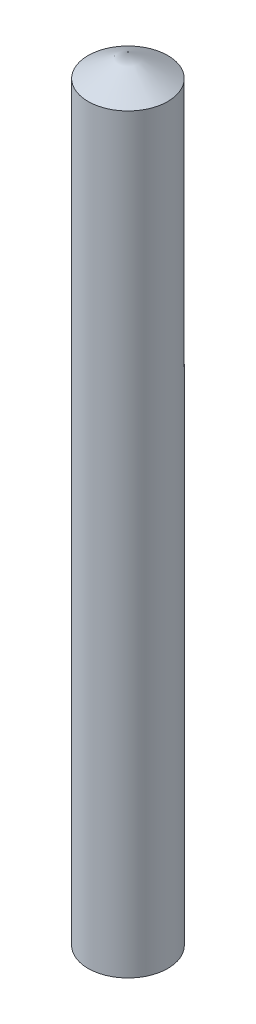
from build123d import *


with BuildPart() as part:
    # Sketch1 → Revolve1 (revolve)
    with BuildSketch(Plane(origin=(0, 0, 0), x_dir=(0, 0, -1), z_dir=(1, 0, 0))):
        Polygon((-30, 282.679491924), (-30, -282.679491924), (0, -300), (0, 300), align=None)
    revolve(axis=Axis((0, 321.806769231, 0), (0, -1, 0)))


solid = part.part
